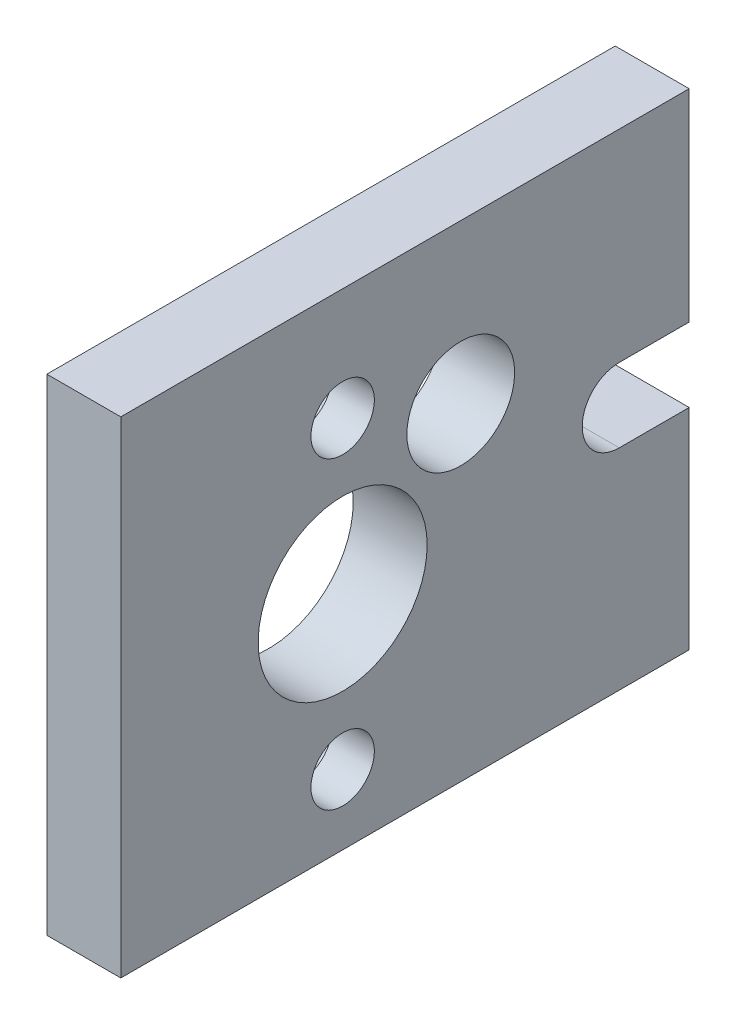
from build123d import *

# Parameters (mm, degrees)
SKETCH_1_W          = 21
SKETCH_1_H          = 21
SKETCH_1_R          = 4
EXTRUDE_1_DEPTH     = 3.5
SKETCH_2_R          = 2.25
SKETCH_2_R_2        = 1.5
CUT_EXTRUDE_1_DEPTH = 1.5
SKETCH_2_2_R        = 1.5
CUT_EXTRUDE_2_DEPTH = 16.256146302
SKETCH_4_R          = 2.55
CUT_EXTRUDE_3_DEPTH = 16.256146302
EXTRUDE_2_DEPTH     = 3.5
SKETCH_6_W          = 26.9
SKETCH_6_H          = 2
EXTRUDE_3_DEPTH     = 3.5


with BuildPart() as part:
    # 草图1 → 凸台-拉伸1 (new body)
    with BuildSketch(Plane(origin=(0, 0, 0), x_dir=(0, 0, -1), z_dir=(1, 0, 0))):
        Rectangle(SKETCH_1_W, SKETCH_1_H)
        Circle(SKETCH_1_R, mode=Mode.SUBTRACT)
    extrude(amount=EXTRUDE_1_DEPTH)

    # 草图2 → 切除-拉伸1 (cut)
    # profile 1 of 2: a face of its own
    with BuildSketch(Plane.ZY):
        with Locations((0, 7.2)):
            Circle(SKETCH_2_R)
        with Locations((0, 7.2)):
            Circle(SKETCH_2_R_2, mode=Mode.SUBTRACT)
    # profile 2 of 2: a face of its own
    with BuildSketch(Plane.ZY):
        with Locations((0, -7.2)):
            Circle(SKETCH_2_R)
        with Locations((0, -7.2)):
            Circle(SKETCH_2_R_2, mode=Mode.SUBTRACT)
    extrude(amount=-CUT_EXTRUDE_1_DEPTH, mode=Mode.SUBTRACT)

    # 草图2<2> → 切除-拉伸2 (cut, through all)
    with BuildSketch(Plane.ZY):
        with Locations((0, 7.2)):
            Circle(SKETCH_2_2_R)
        with Locations((0, -7.2)):
            Circle(SKETCH_2_2_R)
    extrude(amount=-CUT_EXTRUDE_2_DEPTH, mode=Mode.SUBTRACT)

    # 草图4 → 切除-拉伸3 (cut, through all)
    with BuildSketch(Plane.ZY):
        with Locations((-5.590169944, 5)):
            Circle(SKETCH_4_R)
    extrude(amount=-CUT_EXTRUDE_3_DEPTH, mode=Mode.SUBTRACT)

    # 草图5 → 凸台-拉伸2 (add)
    with BuildSketch(Plane.ZY):
        with BuildLine():
            Line((-10.5, -10.5), (-10.5, 10.5))
            Line((-10.5, 10.5), (-16.4, 10.5))
            Line((-16.4, 10.5), (-16.4, 2.934341014))
            Line((-16.4, 2.934341014), (-13.090169944, 2.934341014))
            ThreePointArc((-13.090169944, 2.934341014), (-11.852733077, 2.421777882), (-11.340169944, 1.184341014))
            ThreePointArc((-11.340169944, 1.184341014), (-11.852733077, -0.053095853), (-13.090169944, -0.565658986))
            Line((-13.090169944, -0.565658986), (-16.4, -0.565658986))
            Line((-16.4, -0.565658986), (-16.4, -10.5))
            Line((-16.4, -10.5), (-10.5, -10.5))
        make_face()
    extrude(amount=-EXTRUDE_2_DEPTH)

    # 草图6 → 凸台-拉伸3 (add)
    with BuildSketch(Plane.ZY):
        with Locations((-2.95, 11.5)):
            Rectangle(SKETCH_6_W, SKETCH_6_H)
    extrude(amount=-EXTRUDE_3_DEPTH)


solid = part.part
